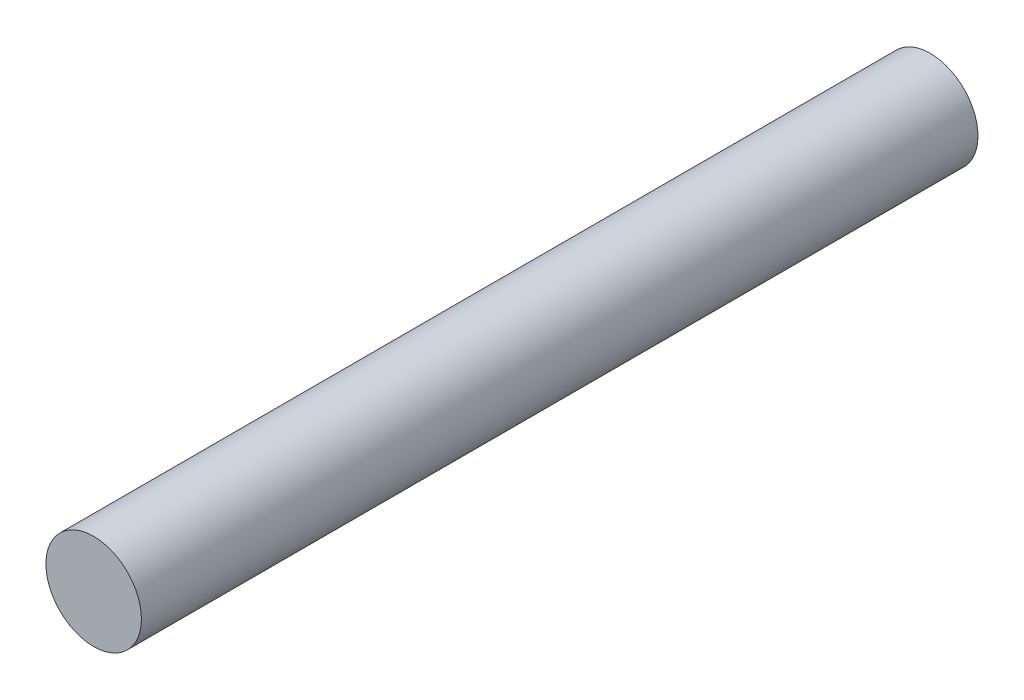
from build123d import *

# Parameters (mm, degrees)
SKETCH1_R           = 2.5
BOSS_EXTRUDE1_DEPTH = 43.8


with BuildPart() as part:
    # Sketch1 → Boss-Extrude1 (new body)
    with BuildSketch(Plane.XY):
        Circle(SKETCH1_R)
    extrude(amount=BOSS_EXTRUDE1_DEPTH)


solid = part.part
